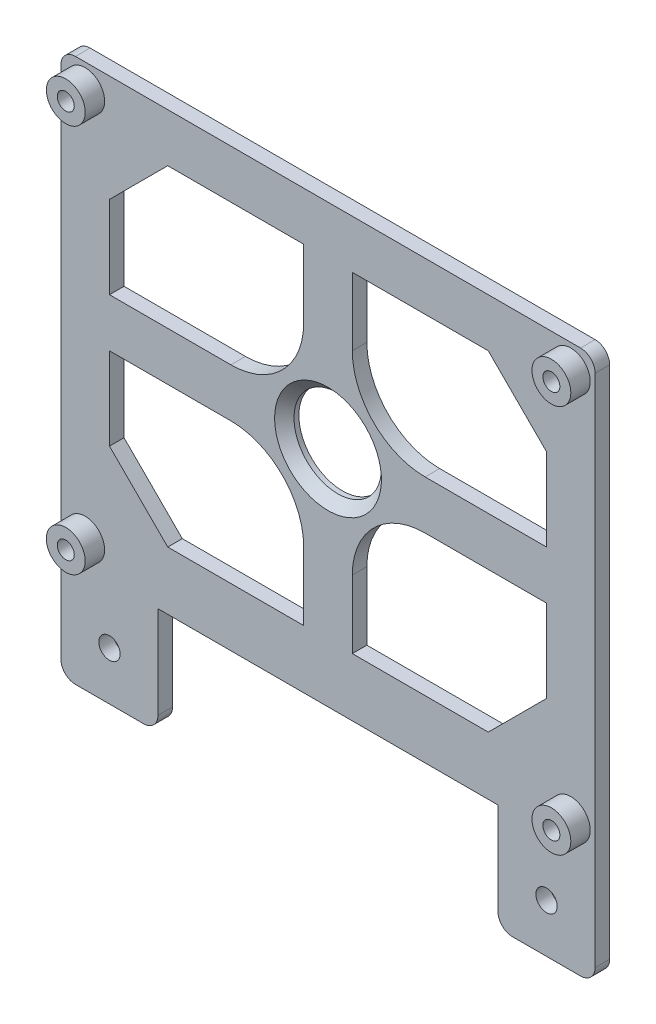
from build123d import *

# Parameters (mm, degrees)
SKETCH1_W           = 110
SKETCH1_H           = 112
BOSS_EXTRUDE1_DEPTH = 3
SKETCH2_R           = 9
SKETCH2_W           = 70
SKETCH2_H           = 22
CUT_EXTRUDE1_DEPTH  = 79.549347547
CUT_EXTRUDE2_DEPTH  = 79.549347547
CHAMFER1_SIZE       = 2
SKETCH4_R           = 4
BOSS_EXTRUDE2_DEPTH = 4
SKETCH5_R           = 1.75
CUT_EXTRUDE3_DEPTH  = 79.803553219
FILLET1_R           = 3
SKETCH6_R           = 2.2
CUT_EXTRUDE4_DEPTH  = 79.593892893


with BuildPart() as part:
    # Sketch1 → Boss-Extrude1 (new body)
    with BuildSketch(Plane.XY):
        Rectangle(SKETCH1_W, SKETCH1_H)
    extrude(amount=BOSS_EXTRUDE1_DEPTH)

    # Sketch2 → Cut-Extrude1 (cut, through all)
    with BuildSketch(Plane.XY.offset(3)):
        with Locations((0, 12)):
            Circle(SKETCH2_R)
        with Locations((0, -45)):
            Rectangle(SKETCH2_W, SKETCH2_H)
    extrude(amount=-CUT_EXTRUDE1_DEPTH, mode=Mode.SUBTRACT)

    # Sketch3 → Cut-Extrude2 (cut, through all)
    with BuildSketch(Plane.XY.offset(3)):
        with BuildLine():
            Line((-33, 46), (-5, 46))
            Line((-5, 46), (-5, 32))
            ThreePointArc((-5, 32), (-9.393398282, 21.393398282), (-20, 17))
            Line((-20, 17), (-45, 17))
            Line((-45, 17), (-45, 34))
            Line((-45, 34), (-33, 46))
        make_face()
        with BuildLine():
            Line((45, 34), (33, 46))
            Line((33, 46), (5, 46))
            Line((5, 46), (5, 32))
            ThreePointArc((5, 32), (9.393398282, 21.393398282), (20, 17))
            Line((20, 17), (45, 17))
            Line((45, 17), (45, 34))
        make_face()
        with BuildLine():
            Line((33, -22), (5, -22))
            Line((5, -22), (5, -8))
            ThreePointArc((5, -8), (9.393398282, 2.606601718), (20, 7))
            Line((20, 7), (45, 7))
            Line((45, 7), (45, -10))
            Line((45, -10), (33, -22))
        make_face()
        with BuildLine():
            Line((-45, -10), (-33, -22))
            Line((-33, -22), (-5, -22))
            Line((-5, -22), (-5, -8))
            ThreePointArc((-5, -8), (-9.393398282, 2.606601718), (-20, 7))
            Line((-20, 7), (-45, 7))
            Line((-45, 7), (-45, -10))
        make_face()
    extrude(amount=-CUT_EXTRUDE2_DEPTH, mode=Mode.SUBTRACT)

    # Chamfer1
    chamfer1_edges = [part.edges().sort_by_distance(p)[0] for p in [
        (-9, 12, 3),
    ]]
    chamfer(chamfer1_edges, length=CHAMFER1_SIZE)

    # Sketch4 → Boss-Extrude2 (add)
    with BuildSketch(Plane.XY.offset(3)):
        with Locations(Location((-50, -29, 0), (0, 0, 180))):
            Circle(SKETCH4_R)
        with Locations(Location((50, -29, 0), (0, 0, 180))):
            Circle(SKETCH4_R)
        with Locations(Location((50, 51, 0), (0, 0, 180))):
            Circle(SKETCH4_R)
        with Locations(Location((-50, 51, 0), (0, 0, 180))):
            Circle(SKETCH4_R)
    extrude(amount=BOSS_EXTRUDE2_DEPTH)

    # Sketch5 → Cut-Extrude3 (cut, through all)
    with BuildSketch(Plane.XY.offset(7)):
        with Locations((-50, 51)):
            Circle(SKETCH5_R)
        with Locations((50, 51)):
            Circle(SKETCH5_R)
        with Locations((50, -29)):
            Circle(SKETCH5_R)
        with Locations((-50, -29)):
            Circle(SKETCH5_R)
    extrude(amount=-CUT_EXTRUDE3_DEPTH, mode=Mode.SUBTRACT)

    # Fillet1
    fillet1_edges = [part.edges().sort_by_distance(p)[0] for p in [
        (-35, -56, 1.5),
        (35, -56, 1.5),
        (-55, 56, 1.5),
        (55, 56, 1.5),
        (55, -56, 1.5),
        (-55, -56, 1.5),
    ]]
    fillet(fillet1_edges, radius=FILLET1_R)

    # Sketch6 → Cut-Extrude4 (cut, through all)
    with BuildSketch(Plane.XY.offset(3)):
        with Locations((-45, -46)):
            Circle(SKETCH6_R)
        with Locations((45, -46)):
            Circle(SKETCH6_R)
    extrude(amount=-CUT_EXTRUDE4_DEPTH, mode=Mode.SUBTRACT)


solid = part.part
